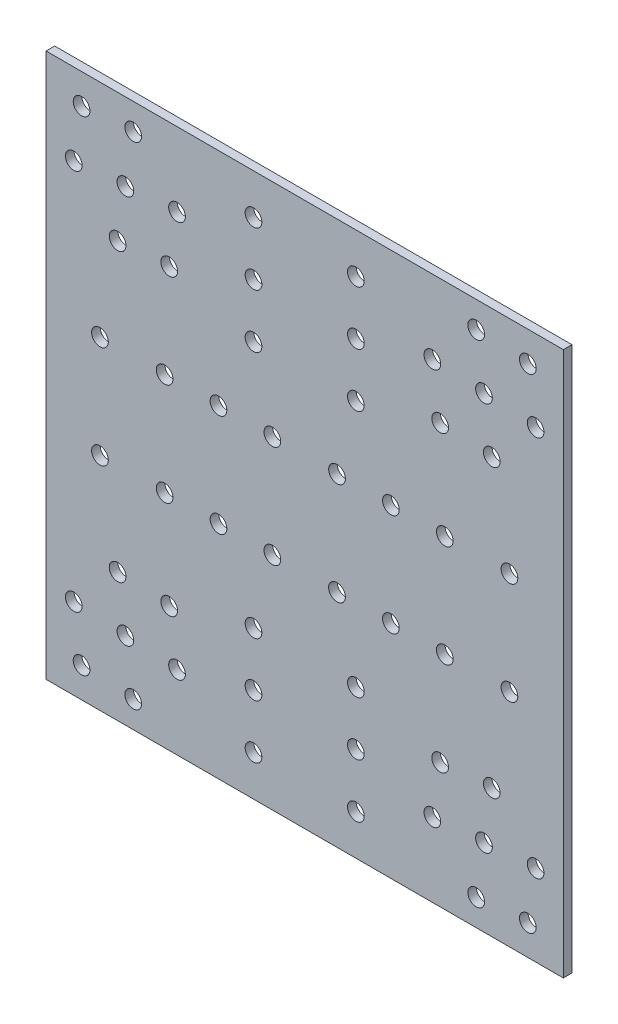
from build123d import *

# Parameters (mm, degrees)
SKETCH_1_W      = 960
SKETCH_1_H      = 1010
SKETCH_1_R      = 15.5
EXTRUDE_3_DEPTH = 16


with BuildPart() as part:
    # 草图1 → 拉伸3 (new body)
    with BuildSketch(Plane.XY):
        with Locations((441.964087771, -474.512070354)):
            Rectangle(SKETCH_1_W, SKETCH_1_H)
        with Locations((190.531101581, -747.31686037)):
            Circle(SKETCH_1_R, mode=Mode.SUBTRACT)
        with Locations((27.879035044, -923.794352563)):
            Circle(SKETCH_1_R, mode=Mode.SUBTRACT)
        with Locations((109.205068312, -835.555606466)):
            Circle(SKETCH_1_R, mode=Mode.SUBTRACT)
        with Locations((205.017301257, -842.265004211)):
            Circle(SKETCH_1_R, mode=Mode.SUBTRACT)
        with Locations(Location((94.718868636, -740.607462625, 0), (0, 0, 180))):
            Circle(SKETCH_1_R, mode=Mode.SUBTRACT)
        with Locations((346.964087771, -904.512070354)):
            Circle(SKETCH_1_R, mode=Mode.SUBTRACT)
        with Locations((346.964087771, -704.512070354)):
            Circle(SKETCH_1_R, mode=Mode.SUBTRACT)
        with Locations((346.964087771, -804.512070354)):
            Circle(SKETCH_1_R, mode=Mode.SUBTRACT)
        with Locations((381.964087771, -569.512070354)):
            Circle(SKETCH_1_R, mode=Mode.SUBTRACT)
        with Locations((181.964087771, -569.512070354)):
            Circle(SKETCH_1_R, mode=Mode.SUBTRACT)
        with Locations((281.964087771, -569.512070354)):
            Circle(SKETCH_1_R, mode=Mode.SUBTRACT)
        with Locations((61.964087771, -569.512070354)):
            Circle(SKETCH_1_R, mode=Mode.SUBTRACT)
        with Locations((13.392835367, -828.846208722)):
            Circle(SKETCH_1_R, mode=Mode.SUBTRACT)
        with Locations(Location((123.691267988, -930.503750308, 0), (0, 0, 180))):
            Circle(SKETCH_1_R, mode=Mode.SUBTRACT)
        with Locations((760.236907554, -930.503750308)):
            Circle(SKETCH_1_R, mode=Mode.SUBTRACT)
        with Locations(Location((870.535340175, -828.846208722, 0), (0, 0, 180))):
            Circle(SKETCH_1_R, mode=Mode.SUBTRACT)
        with Locations(Location((821.964087771, -569.512070354, 0), (0, 0, 180))):
            Circle(SKETCH_1_R, mode=Mode.SUBTRACT)
        with Locations(Location((601.964087771, -569.512070354, 0), (0, 0, 180))):
            Circle(SKETCH_1_R, mode=Mode.SUBTRACT)
        with Locations(Location((701.964087771, -569.512070354, 0), (0, 0, 180))):
            Circle(SKETCH_1_R, mode=Mode.SUBTRACT)
        with Locations(Location((501.964087771, -569.512070354, 0), (0, 0, 180))):
            Circle(SKETCH_1_R, mode=Mode.SUBTRACT)
        with Locations(Location((536.964087771, -804.512070354, 0), (0, 0, 180))):
            Circle(SKETCH_1_R, mode=Mode.SUBTRACT)
        with Locations(Location((536.964087771, -704.512070354, 0), (0, 0, 180))):
            Circle(SKETCH_1_R, mode=Mode.SUBTRACT)
        with Locations(Location((536.964087771, -904.512070354, 0), (0, 0, 180))):
            Circle(SKETCH_1_R, mode=Mode.SUBTRACT)
        with Locations((789.209306906, -740.607462625)):
            Circle(SKETCH_1_R, mode=Mode.SUBTRACT)
        with Locations(Location((678.910874285, -842.265004211, 0), (0, 0, 180))):
            Circle(SKETCH_1_R, mode=Mode.SUBTRACT)
        with Locations(Location((774.72310723, -835.555606466, 0), (0, 0, 180))):
            Circle(SKETCH_1_R, mode=Mode.SUBTRACT)
        with Locations(Location((856.049140499, -923.794352563, 0), (0, 0, 180))):
            Circle(SKETCH_1_R, mode=Mode.SUBTRACT)
        with Locations(Location((693.397073961, -747.31686037, 0), (0, 0, 180))):
            Circle(SKETCH_1_R, mode=Mode.SUBTRACT)
        with Locations((693.397073961, -201.707280338)):
            Circle(SKETCH_1_R, mode=Mode.SUBTRACT)
        with Locations((856.049140499, -25.229788144)):
            Circle(SKETCH_1_R, mode=Mode.SUBTRACT)
        with Locations((774.72310723, -113.468534241)):
            Circle(SKETCH_1_R, mode=Mode.SUBTRACT)
        with Locations((678.910874285, -106.759136496)):
            Circle(SKETCH_1_R, mode=Mode.SUBTRACT)
        with Locations(Location((789.209306906, -208.416678082, 0), (0, 0, 180))):
            Circle(SKETCH_1_R, mode=Mode.SUBTRACT)
        with Locations((536.964087771, -44.512070354)):
            Circle(SKETCH_1_R, mode=Mode.SUBTRACT)
        with Locations((536.964087771, -244.512070354)):
            Circle(SKETCH_1_R, mode=Mode.SUBTRACT)
        with Locations((536.964087771, -144.512070354)):
            Circle(SKETCH_1_R, mode=Mode.SUBTRACT)
        with Locations((501.964087771, -379.512070354)):
            Circle(SKETCH_1_R, mode=Mode.SUBTRACT)
        with Locations((701.964087771, -379.512070354)):
            Circle(SKETCH_1_R, mode=Mode.SUBTRACT)
        with Locations((601.964087771, -379.512070354)):
            Circle(SKETCH_1_R, mode=Mode.SUBTRACT)
        with Locations((821.964087771, -379.512070354)):
            Circle(SKETCH_1_R, mode=Mode.SUBTRACT)
        with Locations((870.535340175, -120.177931986)):
            Circle(SKETCH_1_R, mode=Mode.SUBTRACT)
        with Locations(Location((760.236907554, -18.520390399, 0), (0, 0, 180))):
            Circle(SKETCH_1_R, mode=Mode.SUBTRACT)
        with Locations((123.691267988, -18.520390399)):
            Circle(SKETCH_1_R, mode=Mode.SUBTRACT)
        with Locations(Location((13.392835367, -120.177931986, 0), (0, 0, 180))):
            Circle(SKETCH_1_R, mode=Mode.SUBTRACT)
        with Locations(Location((61.964087771, -379.512070354, 0), (0, 0, 180))):
            Circle(SKETCH_1_R, mode=Mode.SUBTRACT)
        with Locations(Location((281.964087771, -379.512070354, 0), (0, 0, 180))):
            Circle(SKETCH_1_R, mode=Mode.SUBTRACT)
        with Locations(Location((181.964087771, -379.512070354, 0), (0, 0, 180))):
            Circle(SKETCH_1_R, mode=Mode.SUBTRACT)
        with Locations(Location((381.964087771, -379.512070354, 0), (0, 0, 180))):
            Circle(SKETCH_1_R, mode=Mode.SUBTRACT)
        with Locations(Location((346.964087771, -144.512070354, 0), (0, 0, 180))):
            Circle(SKETCH_1_R, mode=Mode.SUBTRACT)
        with Locations(Location((346.964087771, -244.512070354, 0), (0, 0, 180))):
            Circle(SKETCH_1_R, mode=Mode.SUBTRACT)
        with Locations(Location((346.964087771, -44.512070354, 0), (0, 0, 180))):
            Circle(SKETCH_1_R, mode=Mode.SUBTRACT)
        with Locations((94.718868636, -208.416678082)):
            Circle(SKETCH_1_R, mode=Mode.SUBTRACT)
        with Locations(Location((205.017301257, -106.759136496, 0), (0, 0, 180))):
            Circle(SKETCH_1_R, mode=Mode.SUBTRACT)
        with Locations(Location((109.205068312, -113.468534241, 0), (0, 0, 180))):
            Circle(SKETCH_1_R, mode=Mode.SUBTRACT)
        with Locations(Location((27.879035044, -25.229788144, 0), (0, 0, 180))):
            Circle(SKETCH_1_R, mode=Mode.SUBTRACT)
        with Locations(Location((190.531101581, -201.707280338, 0), (0, 0, 180))):
            Circle(SKETCH_1_R, mode=Mode.SUBTRACT)
    extrude(amount=EXTRUDE_3_DEPTH)


solid = part.part
